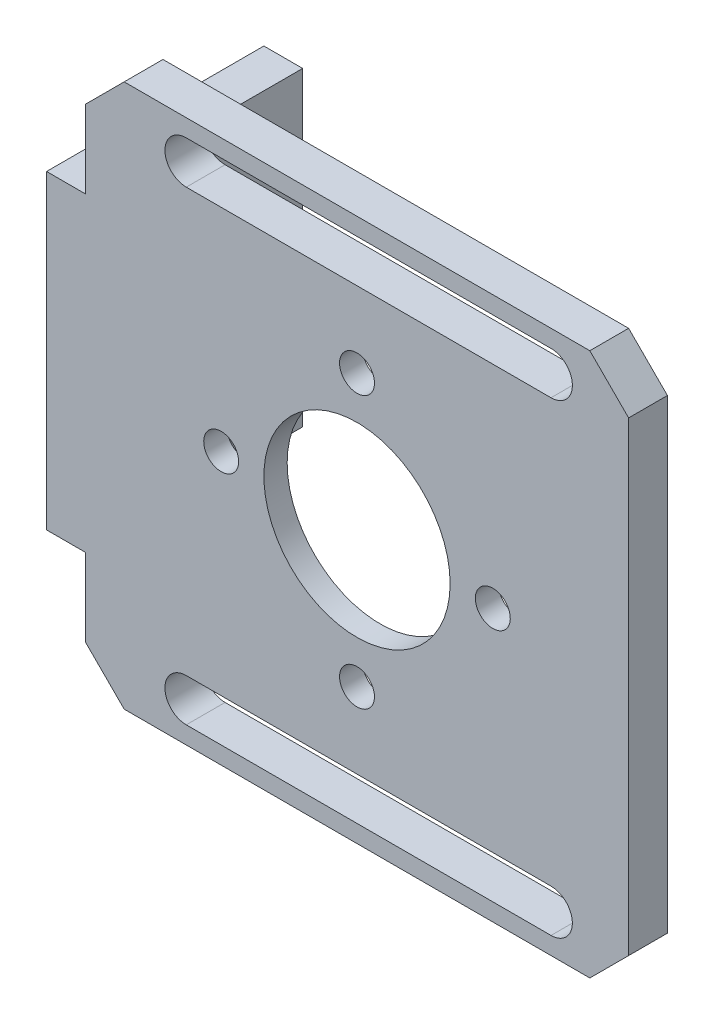
from build123d import *

# Parameters (mm, degrees)
ESQUISSE1_W                  = 70
ESQUISSE1_H                  = 70
EXTRUSION1_DEPTH             = 5
CHANFREIN1_SIZE              = 5
EXTRUSION2_DEPTH             = 23
EXTRUSION2_DEPTH_BACK        = 5
ESQUISSE2_W                  = 5
ESQUISSE2_H                  = 40
ESQUISSE3_R                  = 3
ENL_V_MAT_EXTRU_1_DEPTH      = 82.572054038
ESQUISSE4_R                  = 12
ENL_V_MAT_EXTRU_2_DEPTH      = 61.074953184
ESQUISSE5_R                  = 23.5
ENL_V_MAT_EXTRU_3_DEPTH      = 2
ESQUISSE6_R                  = 2.25
ENL_V_MAT_EXTRU_4_DEPTH      = 61.074953184
R_P_TITION_CIRCULAIRE1_COUNT = 4


with BuildPart() as part:
    # Esquisse1 → Extrusion1 (new body)
    with BuildSketch(Plane.XY):
        Rectangle(ESQUISSE1_W, ESQUISSE1_H)
        with BuildLine():
            Line((-22, 32.75), (25, 32.75))
            ThreePointArc((25, 32.75), (27.75, 30), (25, 27.25))
            Line((25, 27.25), (-22, 27.25))
            ThreePointArc((-22, 27.25), (-24.75, 30), (-22, 32.75))
        make_face(mode=Mode.SUBTRACT)
        with BuildLine():
            Line((-22, -27.25), (25, -27.25))
            ThreePointArc((25, -27.25), (27.75, -30), (25, -32.75))
            Line((25, -32.75), (-22, -32.75))
            ThreePointArc((-22, -32.75), (-24.75, -30), (-22, -27.25))
        make_face(mode=Mode.SUBTRACT)
    extrude(amount=EXTRUSION1_DEPTH)

    # Chanfrein1
    chanfrein1_edges = [part.edges().sort_by_distance(p)[0] for p in [
        (-35, 35, 2.5),
        (35, 35, 2.5),
        (35, -35, 2.5),
        (-35, -35, 2.5),
    ]]
    chamfer(chanfrein1_edges, length=CHANFREIN1_SIZE)

    # Esquisse2 → Extrusion2 (add, two sides: drawn at the far end of the back side and taken through both)
    with BuildSketch(Plane(origin=(0, 0, 0), x_dir=(-1, 0, 0), z_dir=(0, 0, -1)).offset(-EXTRUSION2_DEPTH_BACK)):
        with Locations((37.5, 0)):
            Rectangle(ESQUISSE2_W, ESQUISSE2_H)
    extrude(amount=EXTRUSION2_DEPTH + EXTRUSION2_DEPTH_BACK)

    # Esquisse3 → Enlèv. mat.-Extru.1 (cut, through all)
    with BuildSketch(Plane(origin=(-35, 0, 0), x_dir=(0, 0, -1), z_dir=(1, 0, 0))):
        with Locations((14, 0)):
            Circle(ESQUISSE3_R)
    extrude(amount=-ENL_V_MAT_EXTRU_1_DEPTH, mode=Mode.SUBTRACT)

    # Esquisse4 → Enlèv. mat.-Extru.2 (cut, through all)
    with BuildSketch(Plane.XY.offset(5)):
        Circle(ESQUISSE4_R)
    extrude(amount=-ENL_V_MAT_EXTRU_2_DEPTH, mode=Mode.SUBTRACT)

    # Esquisse5 → Enlèv. mat.-Extru.3 (cut)
    with BuildSketch(Plane(origin=(0, 0, 0), x_dir=(-1, 0, 0), z_dir=(0, 0, -1))):
        Circle(ESQUISSE5_R)
    extrude(amount=-ENL_V_MAT_EXTRU_3_DEPTH, mode=Mode.SUBTRACT)

    # Esquisse6 → Enlèv. mat.-Extru.4 (cut, through all)
    with BuildSketch(Plane.XY.offset(5)):
        with Locations((0, -17.5)):
            Circle(ESQUISSE6_R)
    enl_v_mat_extru_4 = extrude(amount=-ENL_V_MAT_EXTRU_4_DEPTH, mode=Mode.SUBTRACT)

    # Répétition circulaire1: Enlèv. mat.-Extru.4 ×4 about axis
    r_p_tition_circulaire1_axis = Axis((0, 0, 0), (0, 0, 1))
    for i in range(1, R_P_TITION_CIRCULAIRE1_COUNT):
        add(enl_v_mat_extru_4.rotate(r_p_tition_circulaire1_axis, i * 360 / R_P_TITION_CIRCULAIRE1_COUNT), mode=Mode.SUBTRACT)


solid = part.part
